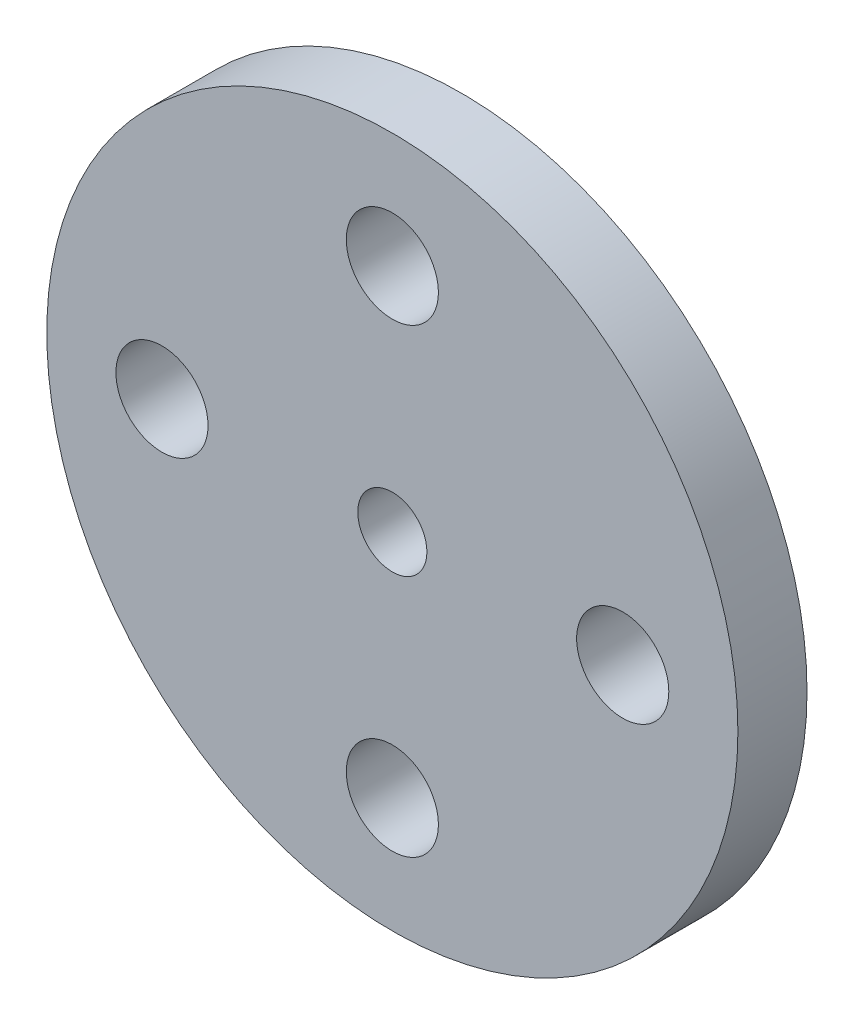
from build123d import *

# Parameters (mm, degrees)
SKETCH_1_R      = 4.5
SKETCH_1_R_2    = 3.5
EXTRUDE_1_DEPTH = 5
SKETCH_2_R      = 15
SKETCH_2_R_2    = 1.5
SKETCH_2_R_3    = 2
EXTRUDE_2_DEPTH = 3


with BuildPart() as part:
    # 草图1 → 凸台-拉伸1 (new body)
    with BuildSketch(Plane.XY):
        Circle(SKETCH_1_R)
        Circle(SKETCH_1_R_2, mode=Mode.SUBTRACT)
    extrude(amount=EXTRUDE_1_DEPTH)

    # 草图2 → 凸台-拉伸2 (add)
    with BuildSketch(Plane.XY.offset(5)):
        Circle(SKETCH_2_R)
        Circle(SKETCH_2_R_2, mode=Mode.SUBTRACT)
        with Locations((0, 10)):
            Circle(SKETCH_2_R_3, mode=Mode.SUBTRACT)
        with Locations((10, 0)):
            Circle(SKETCH_2_R_3, mode=Mode.SUBTRACT)
        with Locations((0, -10)):
            Circle(SKETCH_2_R_3, mode=Mode.SUBTRACT)
        with Locations((-10, 0)):
            Circle(SKETCH_2_R_3, mode=Mode.SUBTRACT)
    extrude(amount=EXTRUDE_2_DEPTH)


solid = part.part
